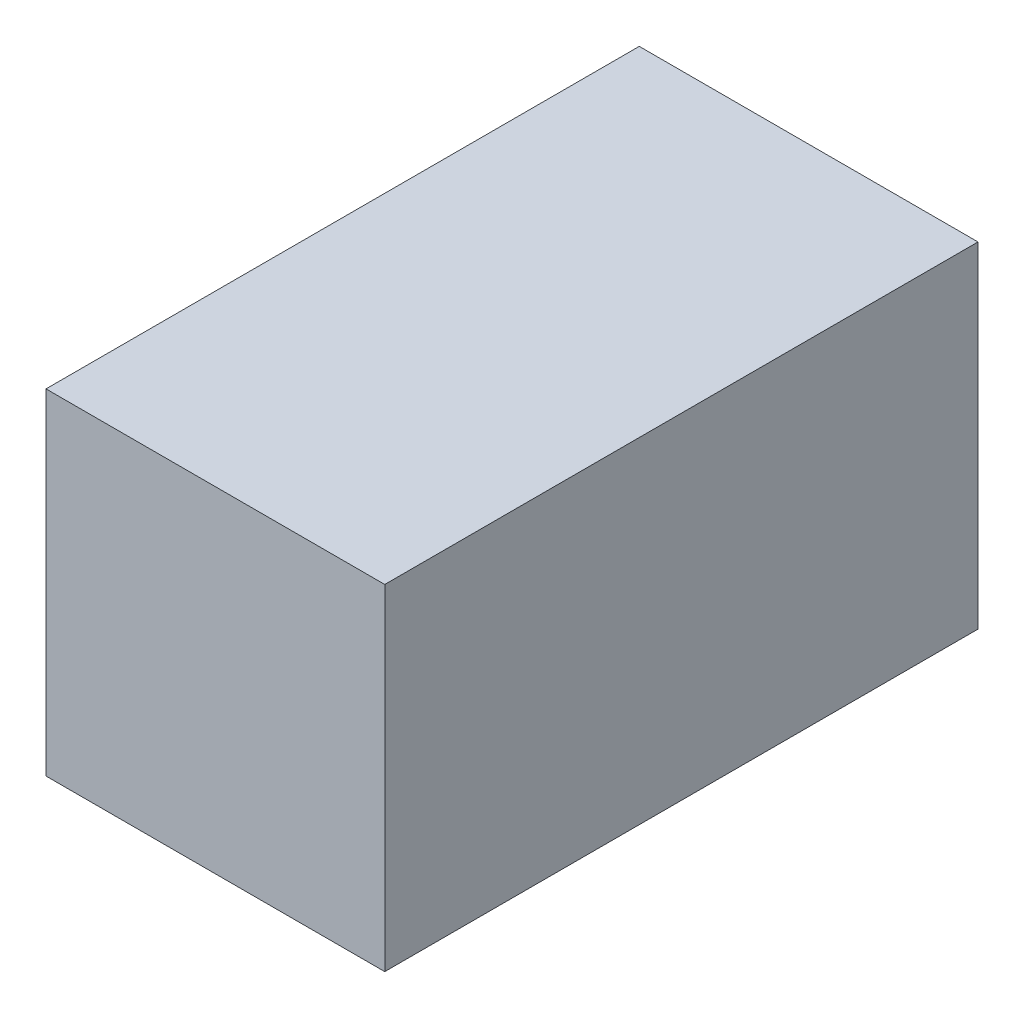
from build123d import *

# Parameters (mm, degrees)
SKETCH1_W               = 10.0076
SKETCH1_H               = 9.906
COMPONENT_OUTLINE_DEPTH = 17.526


with BuildPart() as part:
    # Sketch1 → Component_Outline (new body)
    with BuildSketch(Plane.XY):
        with Locations((2.4638, 0.0508)):
            Rectangle(SKETCH1_W, SKETCH1_H)
    extrude(amount=COMPONENT_OUTLINE_DEPTH)


solid = part.part
